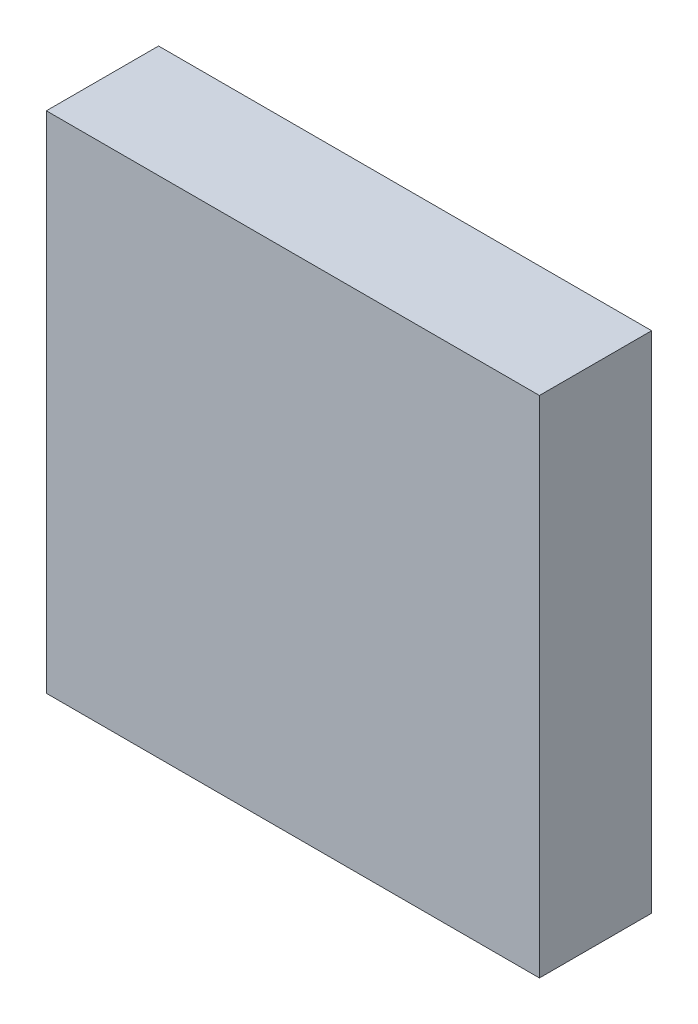
from build123d import *

# Parameters (mm, degrees)
SKETCH1_W           = 197.750866481
SKETCH1_H           = 202.324097921
BOSS_EXTRUDE2_DEPTH = 45


with BuildPart() as part:
    # Sketch1 → Boss-Extrude2 (new body)
    with BuildSketch(Plane.XY):
        with Locations((0.875433241, 48.837951039)):
            Rectangle(SKETCH1_W, SKETCH1_H)
    extrude(amount=BOSS_EXTRUDE2_DEPTH)


solid = part.part
